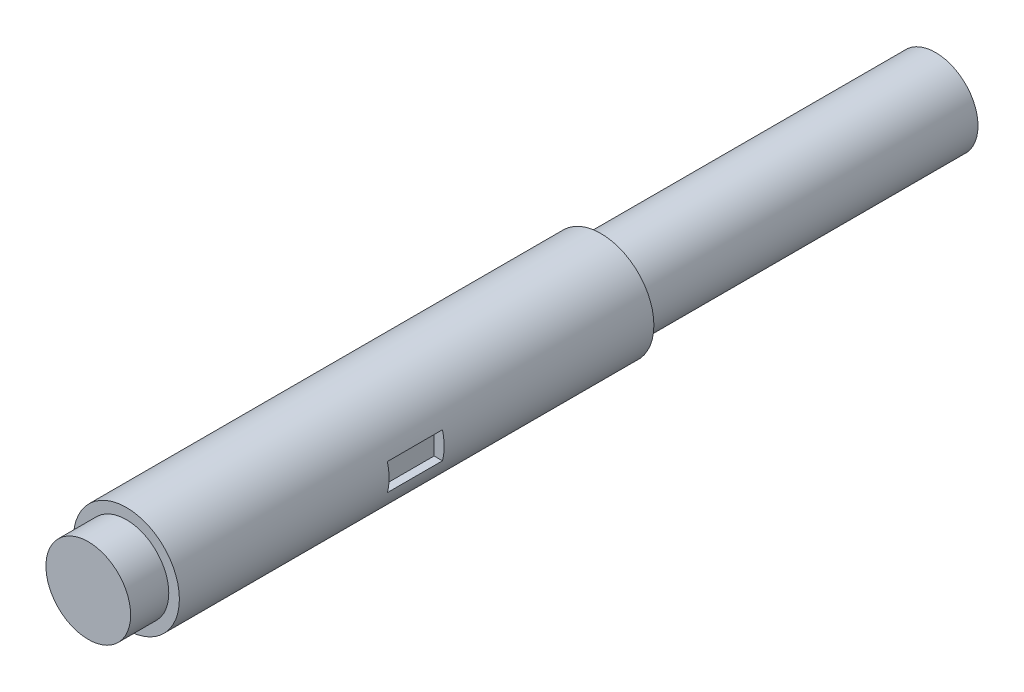
from build123d import *

# Parameters (mm, degrees)
SKETCH1_R           = 12.5
BOSS_EXTRUDE1_DEPTH = 112
SKETCH2_R           = 10
BOSS_EXTRUDE2_DEPTH = 9
BOSS_EXTRUDE3_START = 9
SKETCH3_R           = 10
BOSS_EXTRUDE3_DEPTH = 9
SKETCH4_W           = 13
SKETCH4_H           = 6.35
CUT_EXTRUDE1_DEPTH  = 2.38125
BOSS_EXTRUDE5_START = 70
SKETCH6_R           = 10
BOSS_EXTRUDE5_DEPTH = 70


with BuildPart() as part:
    # Sketch1 → Boss-Extrude1 (new body)
    with BuildSketch(Plane.XY):
        Circle(SKETCH1_R)
    extrude(amount=BOSS_EXTRUDE1_DEPTH)

    # Sketch2 → Boss-Extrude2 (add)
    with BuildSketch(Plane.XY.offset(112)):
        Circle(SKETCH2_R)
    extrude(amount=BOSS_EXTRUDE2_DEPTH)

    # Sketch3 → Boss-Extrude3 (add)
    with BuildSketch(Plane(origin=(0, 0, 0), x_dir=(-1, 0, 0), z_dir=(0, 0, -1)).offset(BOSS_EXTRUDE3_START)):
        with Locations(Location((0, 0, 0), (0, 0, 180))):
            Circle(SKETCH3_R)
    extrude(amount=-BOSS_EXTRUDE3_DEPTH)

    # Sketch4 → Cut-Extrude1 (cut)
    with BuildSketch(Plane(origin=(12.5, 0, 0), x_dir=(0, 0, -1), z_dir=(1, 0, 0))):
        with Locations((-56, 0)):
            Rectangle(SKETCH4_W, SKETCH4_H)
    extrude(amount=-CUT_EXTRUDE1_DEPTH, mode=Mode.SUBTRACT)

    # Sketch6 → Boss-Extrude5 (add)
    with BuildSketch(Plane(origin=(0, 0, -9), x_dir=(-1, 0, 0), z_dir=(0, 0, -1)).offset(BOSS_EXTRUDE5_START)):
        with Locations(Location((0, 0, 0), (0, 0, 180))):
            Circle(SKETCH6_R)
    extrude(amount=-BOSS_EXTRUDE5_DEPTH)


solid = part.part
